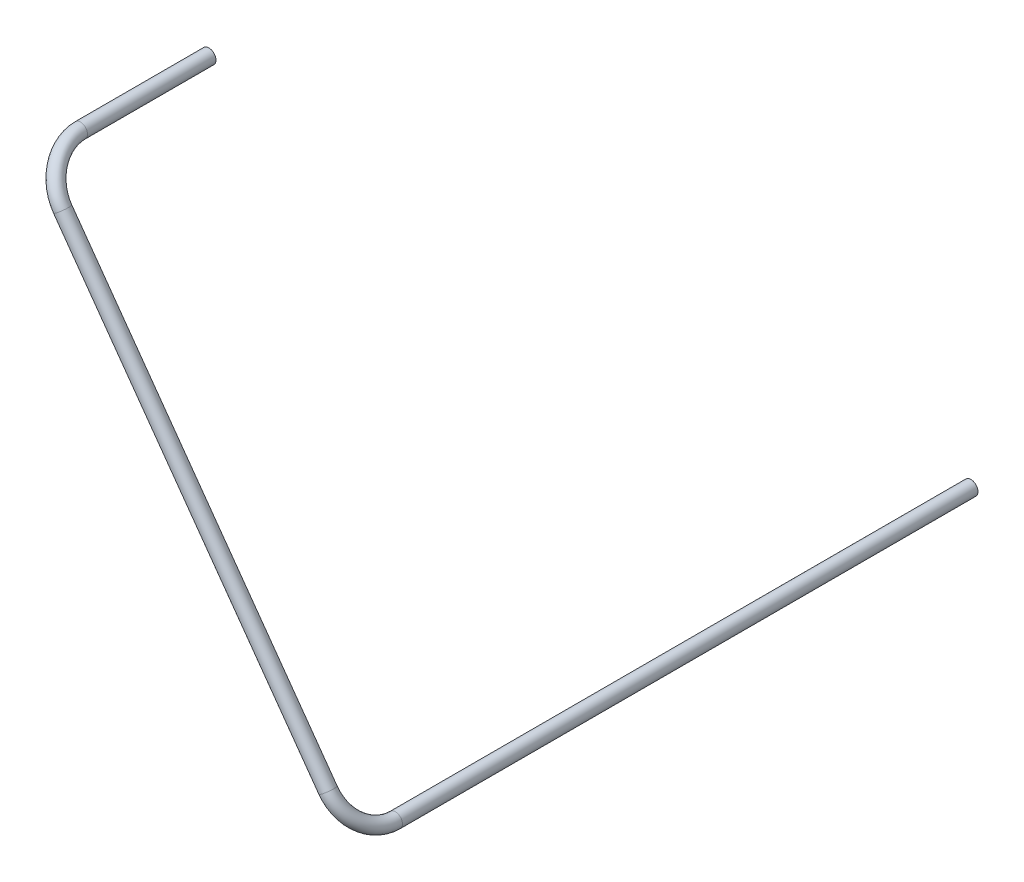
from build123d import *

# Parameters (mm, degrees)
PIPESKETCH_R   = 6.35
PIPESKETCH_R_2 = 5.1054


with BuildPart() as part:
    # ThinSweep: sweep along a curve in space
    with BuildLine() as thinsweep_path:
        Line((0, 0, 0), (0, 0, 115.002872572))
        ThreePointArc((0, 0, 115.002872572), (6.49695017, -9.072931676, 141.943640935), (22.181975386, -30.97692638, 153.102872572))
        Line((22.181975386, -30.97692638, 153.102872572), (259.82889592, -362.848684139, 153.102872572))
        ThreePointArc((282.010871306, -393.825610519, 115.002872572), (275.513921135, -384.752678843, 141.943640935), (259.82889592, -362.848684139, 153.102872572))
        Line((282.010871306, -393.825610519, -400.347253913), (282.010871306, -393.825610519, 115.002872572))
    # PipeSketch → ThinSweep (sweep)
    with BuildSketch(Plane.XY):
        Circle(PIPESKETCH_R)
        Circle(PIPESKETCH_R_2, mode=Mode.SUBTRACT)
    sweep(path=thinsweep_path.line)


solid = part.part
